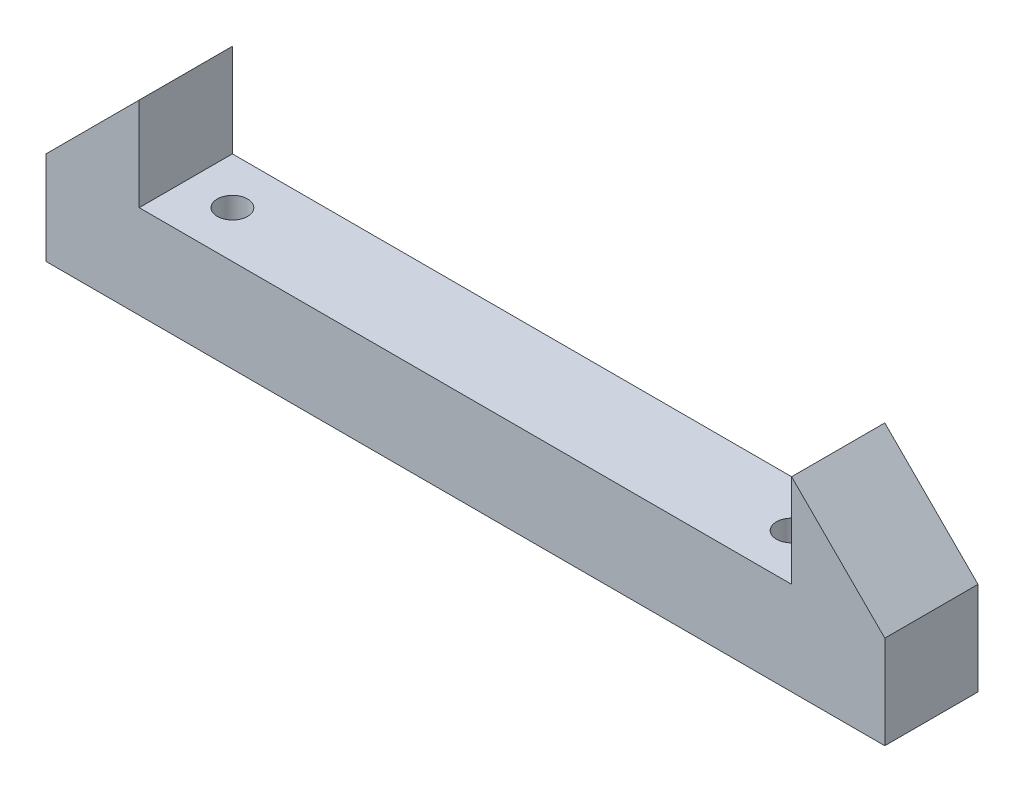
from build123d import *

# Parameters (mm, degrees)
BOSS_EXTRUDE1_DEPTH = 8
CUT_EXTRUDE1_REACH  = 53.887
SKETCH2_R           = 1.3


with BuildPart() as part:
    # Sketch1 → Boss-Extrude1 (new body)
    with BuildSketch(Plane(origin=(0, 0, 0), x_dir=(0, 1, 0), z_dir=(0, 0, 1))):
        Polygon((-44.64033264, 50.63902284), (-44.64033264, -21.36097716), (-36.64033264, -21.36097716), (-28.64033264, -13.36097716), (-36.64033264, -13.36097716), (-36.64033264, 42.63902284), (-28.64033264, 42.63902284), (-36.64033264, 50.63902284), align=None)
    extrude(amount=BOSS_EXTRUDE1_DEPTH)

    # Sketch2 → Cut-Extrude1 (cut, up to next)
    with BuildSketch(Plane(origin=(0, -36.64033264, 0), x_dir=(-1, 0, 0), z_dir=(0, 1, 0)), mode=Mode.PRIVATE) as cut_extrude1_sk1:
        with Locations(Location((-9.36097716, 4, 0), (0, 0, 90))):
            Circle(SKETCH2_R)
    cut_extrude1_tool1 = extrude(cut_extrude1_sk1.sketch, amount=-CUT_EXTRUDE1_REACH, mode=Mode.PRIVATE) & part.part
    # Sketch2 → Cut-Extrude1 (cut, up to next)
    with BuildSketch(Plane(origin=(0, -36.64033264, 0), x_dir=(-1, 0, 0), z_dir=(0, 1, 0)), mode=Mode.PRIVATE) as cut_extrude1_sk2:
        with Locations((38.63902284, 4)):
            Circle(SKETCH2_R)
    cut_extrude1_tool2 = extrude(cut_extrude1_sk2.sketch, amount=-CUT_EXTRUDE1_REACH, mode=Mode.PRIVATE) & part.part
    add(cut_extrude1_tool1.solids().sort_by_distance((9.360977, -36.640333, 4))[0], mode=Mode.SUBTRACT)
    add(cut_extrude1_tool2.solids().sort_by_distance((-38.639023, -36.640333, 4))[0], mode=Mode.SUBTRACT)


solid = part.part
